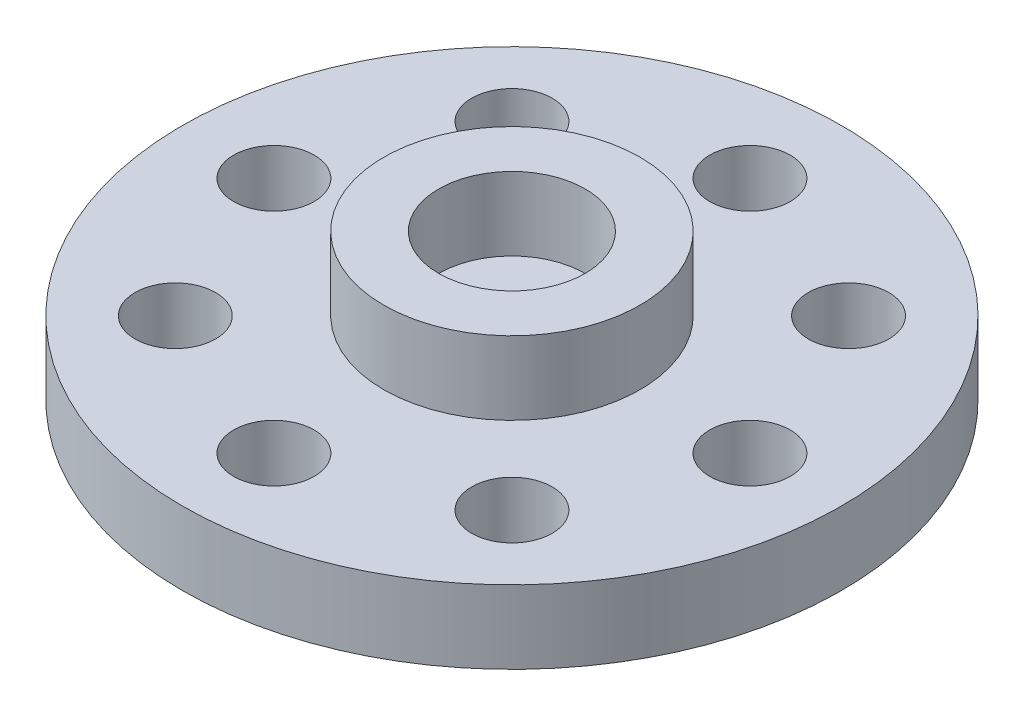
from build123d import *

# Parameters (mm, degrees)
SKETCH_1_R          = 9
EXTRUDE_1_DEPTH     = 2
SKETCH_2_R          = 3.5
SKETCH_2_R_2        = 2
EXTRUDE_2_DEPTH     = 2
SKETCH_3_R          = 1.1
CUT_EXTRUDE_1_DEPTH = 14.341664064


with BuildPart() as part:
    # 草图1 → 凸台-拉伸1 (new body)
    with BuildSketch(Plane(origin=(0, 0, 0), x_dir=(1, 0, 0), z_dir=(0, 1, 0))):
        with Locations(Location((0, 0, 0), (0, 0, 270))):
            Circle(SKETCH_1_R)
    extrude(amount=EXTRUDE_1_DEPTH)

    # 草图2 → 凸台-拉伸2 (add)
    with BuildSketch(Plane(origin=(0, 2, 0), x_dir=(1, 0, 0), z_dir=(0, 1, 0))):
        with Locations(Location((0, 0, 0), (0, 0, 270))):
            Circle(SKETCH_2_R)
        with Locations(Location((0, 0, 0), (0, 0, 270))):
            Circle(SKETCH_2_R_2, mode=Mode.SUBTRACT)
    extrude(amount=EXTRUDE_2_DEPTH)

    # 草图3 → 切除-拉伸1 (cut, through all)
    with BuildSketch(Plane.XZ):
        with Locations(Location((0, 6.5, 0), (0, 0, 270))):
            Circle(SKETCH_3_R)
        with Locations(Location((4.596194078, 4.596194078, 0), (0, 0, 270))):
            Circle(SKETCH_3_R)
        with Locations(Location((6.5, 0, 0), (0, 0, 270))):
            Circle(SKETCH_3_R)
        with Locations(Location((4.596194078, -4.596194078, 0), (0, 0, 270))):
            Circle(SKETCH_3_R)
        with Locations(Location((0, -6.5, 0), (0, 0, 270))):
            Circle(SKETCH_3_R)
        with Locations(Location((-4.596194078, -4.596194078, 0), (0, 0, 270))):
            Circle(SKETCH_3_R)
        with Locations(Location((-6.5, 0, 0), (0, 0, 270))):
            Circle(SKETCH_3_R)
        with Locations(Location((-4.596194078, 4.596194078, 0), (0, 0, 270))):
            Circle(SKETCH_3_R)
    extrude(amount=-CUT_EXTRUDE_1_DEPTH, mode=Mode.SUBTRACT)


solid = part.part
